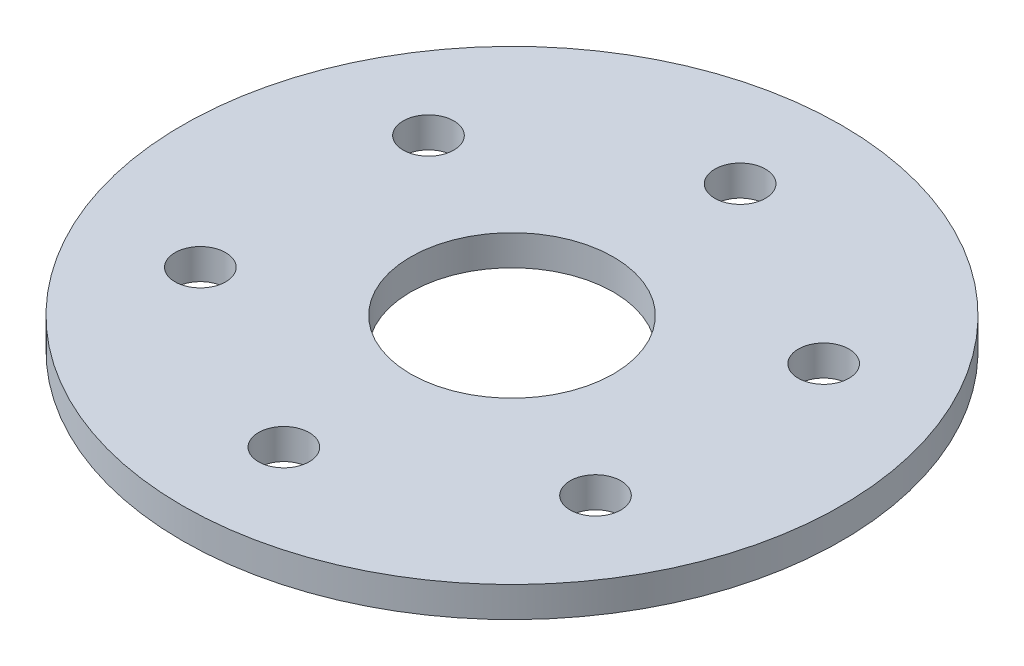
from build123d import *

# Parameters (mm, degrees)
SKETCH_1_R          = 32.5
SKETCH_1_R_2        = 10
EXTRUDE_1_DEPTH     = 3
SKETCH_2_R          = 2.5
CUT_EXTRUDE_1_DEPTH = 3


with BuildPart() as part:
    # 草图1 → 凸台-拉伸1 (new body)
    with BuildSketch(Plane(origin=(0, 0, 0), x_dir=(1, 0, 0), z_dir=(0, 1, 0))):
        with Locations(Location((0, 0, 0), (0, 0, 270))):
            Circle(SKETCH_1_R)
        with Locations(Location((0, 0, 0), (0, 0, 270))):
            Circle(SKETCH_1_R_2, mode=Mode.SUBTRACT)
    extrude(amount=EXTRUDE_1_DEPTH)

    # 草图2 → 切除-拉伸1 (cut)
    with BuildSketch(Plane(origin=(0, 3, 0), x_dir=(1, 0, 0), z_dir=(0, 1, 0))):
        with Locations(Location((0, 22.5, 0), (0, 0, 270))):
            Circle(SKETCH_2_R)
        with Locations(Location((19.485571585, 11.25, 0), (0, 0, 270))):
            Circle(SKETCH_2_R)
        with Locations(Location((19.485571585, -11.25, 0), (0, 0, 270))):
            Circle(SKETCH_2_R)
        with Locations(Location((0, -22.5, 0), (0, 0, 270))):
            Circle(SKETCH_2_R)
        with Locations(Location((-19.485571585, -11.25, 0), (0, 0, 270))):
            Circle(SKETCH_2_R)
        with Locations(Location((-19.485571585, 11.25, 0), (0, 0, 270))):
            Circle(SKETCH_2_R)
    extrude(amount=-CUT_EXTRUDE_1_DEPTH, mode=Mode.SUBTRACT)


solid = part.part
